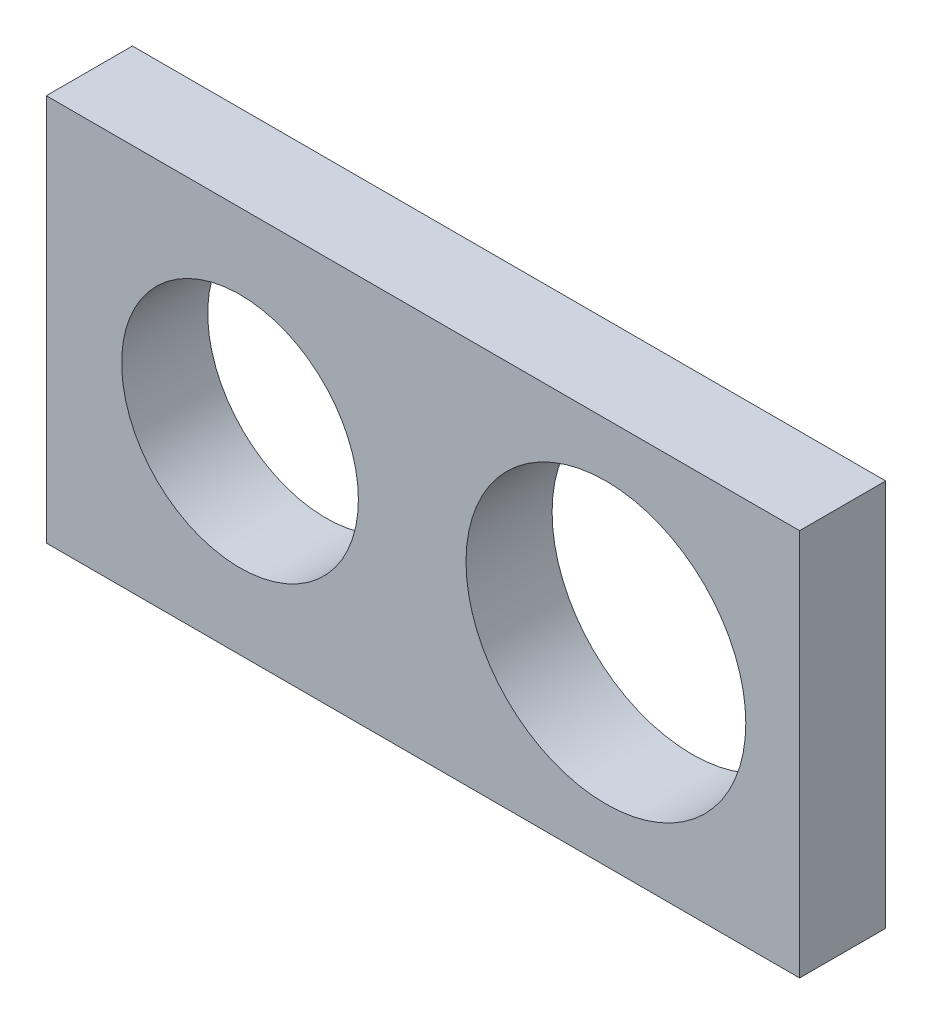
from build123d import *

# Parameters (mm, degrees)
SKETCH_1_W         = 70
SKETCH_1_H         = 36
COUPON_DEPTH       = 8
SKETCH_2_R         = 11
SKETCH_2_R_2       = 13
COUPON_BORES_DEPTH = 15


with BuildPart() as part:
    # Эскиз1 → Coupon (new body)
    with BuildSketch(Plane.XY):
        Rectangle(SKETCH_1_W, SKETCH_1_H)
    extrude(amount=COUPON_DEPTH)

    # Эскиз2 → Coupon_bores (cut, symmetric)
    with BuildSketch(Plane.XY):
        with Locations((-17, 0)):
            Circle(SKETCH_2_R)
        with Locations((17, 0)):
            Circle(SKETCH_2_R_2)
    extrude(amount=COUPON_BORES_DEPTH, both=True, mode=Mode.SUBTRACT)


solid = part.part
